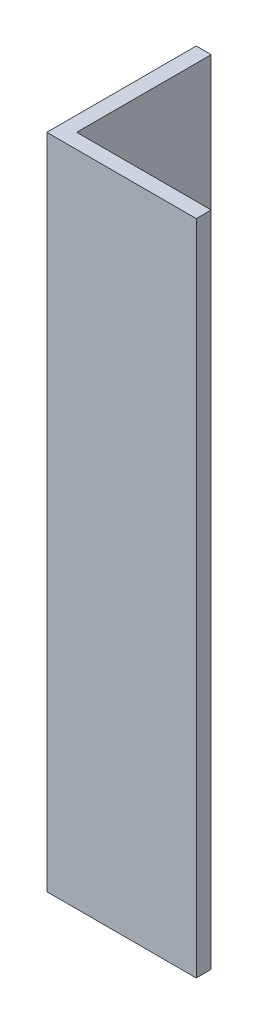
from build123d import *

# Parameters (mm, degrees)
BOSS_EXTRUDE1_DEPTH      = 44
BOSS_EXTRUDE1_DEPTH_BACK = 44


with BuildPart() as part:
    # Sketch1 → Boss-Extrude1 (new, two sides: drawn at the far end of the back side and taken through both)
    with BuildSketch(Plane(origin=(0, 0, 0), x_dir=(1, 0, 0), z_dir=(0, 1, 0)).offset(-BOSS_EXTRUDE1_DEPTH_BACK)):
        Polygon((0, 0), (20, 0), (20, 2), (2, 2), (2, 20), (0, 20), align=None)
    extrude(amount=BOSS_EXTRUDE1_DEPTH + BOSS_EXTRUDE1_DEPTH_BACK)


solid = part.part
